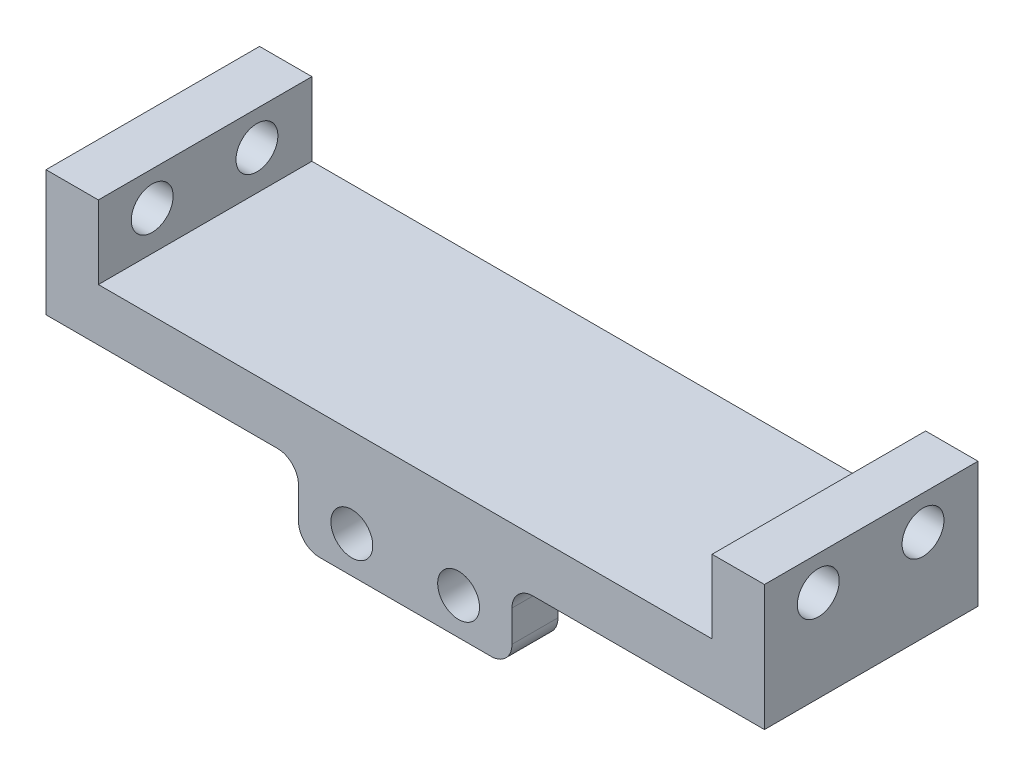
from build123d import *

# Parameters (mm, degrees)
SKETCH1_W                  = 68.6
SKETCH1_H                  = 20.38979341
BRACKETBASE_DEPTH          = 5
SKETCH2_W                  = 20.38979341
SKETCH2_H                  = 12
LEGMOUNTINGTAB_DEPTH       = 5
SKETCH3_R                  = 2
LEGMOUNTINGHOLES_DEPTH     = 5
SKETCH4_W                  = 20.38979341
SKETCH4_H                  = 7
ARDUINOMOUNTINGTAB_DEPTH   = 4.38979341
SKETCH5_R                  = 2
ARDUINOMOUNTINGHOLES_DEPTH = 5
FILLET1_R                  = 2


with BuildPart() as part:
    # Sketch1 → bracketBase (new body)
    with BuildSketch(Plane(origin=(0, 0, 0), x_dir=(1, 0, 0), z_dir=(0, 1, 0))):
        with Locations((34.3, 10.194896705)):
            Rectangle(SKETCH1_W, SKETCH1_H)
    extrude(amount=BRACKETBASE_DEPTH)

    # Sketch2 → legMountingTab (add)
    with BuildSketch(Plane.ZY):
        with Locations((-10.194896705, 6)):
            Rectangle(SKETCH2_W, SKETCH2_H)
    legmountingtab = extrude(amount=-LEGMOUNTINGTAB_DEPTH)

    # Sketch3 → legMountingHoles (cut)
    with BuildSketch(Plane(origin=(5, 0, 0), x_dir=(0, 0, -1), z_dir=(1, 0, 0))):
        with Locations((15.13979341, 8.75)):
            Circle(SKETCH3_R)
        with Locations((5.13979341, 8.75)):
            Circle(SKETCH3_R)
    legmountingholes = extrude(amount=-LEGMOUNTINGHOLES_DEPTH, mode=Mode.SUBTRACT)

    # legMountingHoles2: legMountingTab, legMountingHoles across plane
    add(legmountingtab.mirror(Plane.ZY.offset(-34.3)))
    add(legmountingholes.mirror(Plane.ZY.offset(-34.3)), mode=Mode.SUBTRACT)

    # Sketch4 → arduinoMountingTab (add)
    with BuildSketch(Plane.XY):
        with Locations((34.3, -3.5)):
            Rectangle(SKETCH4_W, SKETCH4_H)
    extrude(amount=-ARDUINOMOUNTINGTAB_DEPTH)

    # Sketch5 → arduinoMountingHoles (cut)
    with BuildSketch(Plane.XY):
        with Locations((39.397448352, -3.5)):
            Circle(SKETCH5_R)
        with Locations(Location((29.202551647, -3.5, 0), (0, 0, 180))):
            Circle(SKETCH5_R)
    extrude(amount=-ARDUINOMOUNTINGHOLES_DEPTH, mode=Mode.SUBTRACT)

    # Fillet1
    fillet1_edges = [part.edges().sort_by_distance(p)[0] for p in [
        (44.494896705, 0, -2.194896705),
        (44.494896705, -7, -2.194896705),
        (24.105103295, -7, -2.194896705),
        (24.105103295, 0, -2.194896705),
    ]]
    fillet(fillet1_edges, radius=FILLET1_R)


solid = part.part
